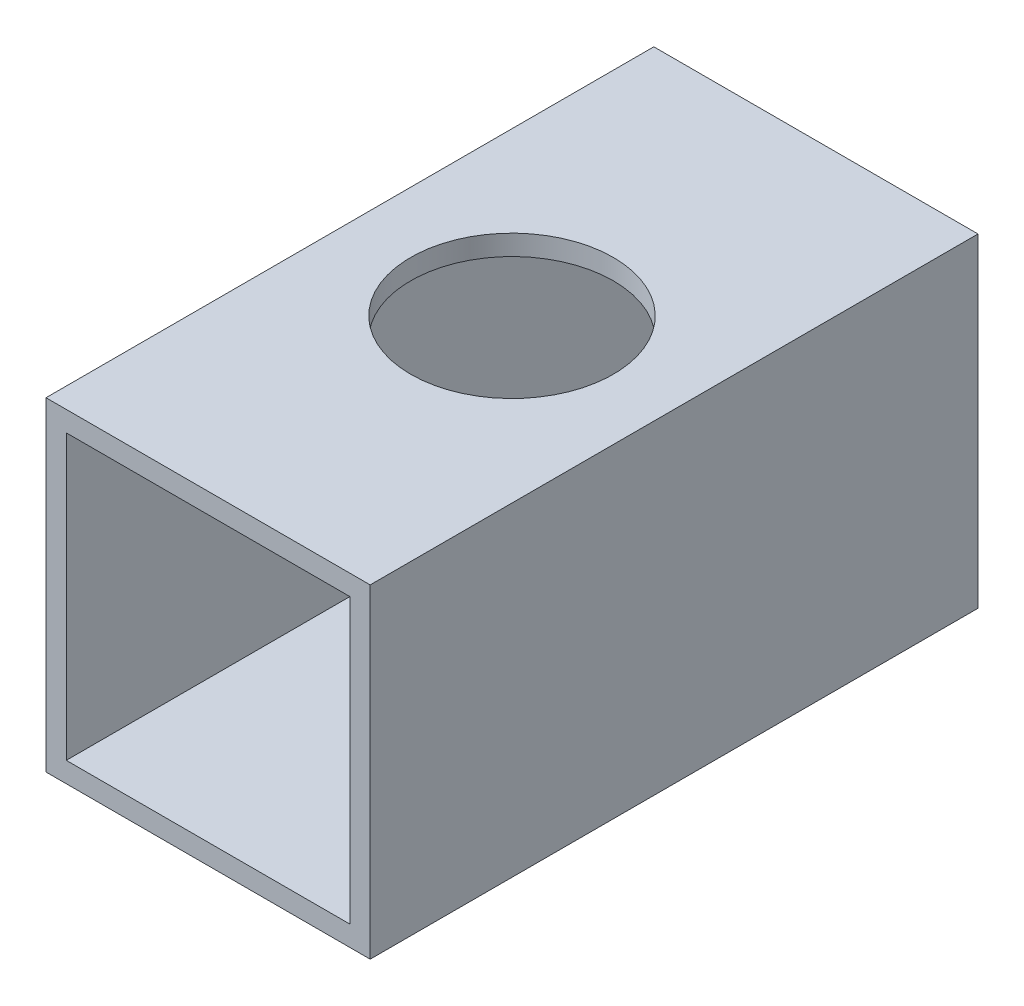
from build123d import *

# Parameters (mm, degrees)
SKIZZE1_W                       = 16
SKIZZE1_H                       = 16
SKIZZE1_W_2                     = 14
SKIZZE1_H_2                     = 14
AUFSATZ_LINEAR_AUSTRAGEN1_DEPTH = 15
SKIZZE2_R                       = 2.5
SCHNITT_LINEAR_AUSTRAGEN1_DEPTH = 30
SKIZZE3_R                       = 5
SCHNITT_LINEAR_AUSTRAGEN2_DEPTH = 5


with BuildPart() as part:
    # Skizze1 → Aufsatz-Linear austragen1 (new, symmetric)
    with BuildSketch(Plane.XY):
        Rectangle(SKIZZE1_W, SKIZZE1_H)
        Rectangle(SKIZZE1_W_2, SKIZZE1_H_2, mode=Mode.SUBTRACT)
    extrude(amount=AUFSATZ_LINEAR_AUSTRAGEN1_DEPTH, both=True)

    # Skizze2 → Schnitt-Linear austragen1 (cut)
    with BuildSketch(Plane(origin=(0, 8, 0), x_dir=(1, 0, 0), z_dir=(0, 1, 0))):
        with Locations(Location((0, 0, 0), (0, 0, 270))):
            Circle(SKIZZE2_R)
    extrude(amount=-SCHNITT_LINEAR_AUSTRAGEN1_DEPTH, mode=Mode.SUBTRACT)

    # Skizze3 → Schnitt-Linear austragen2 (cut)
    with BuildSketch(Plane(origin=(0, 8, 0), x_dir=(1, 0, 0), z_dir=(0, 1, 0))):
        with Locations(Location((0, 0, 0), (0, 0, 270))):
            Circle(SKIZZE3_R)
    extrude(amount=-SCHNITT_LINEAR_AUSTRAGEN2_DEPTH, mode=Mode.SUBTRACT)


solid = part.part
